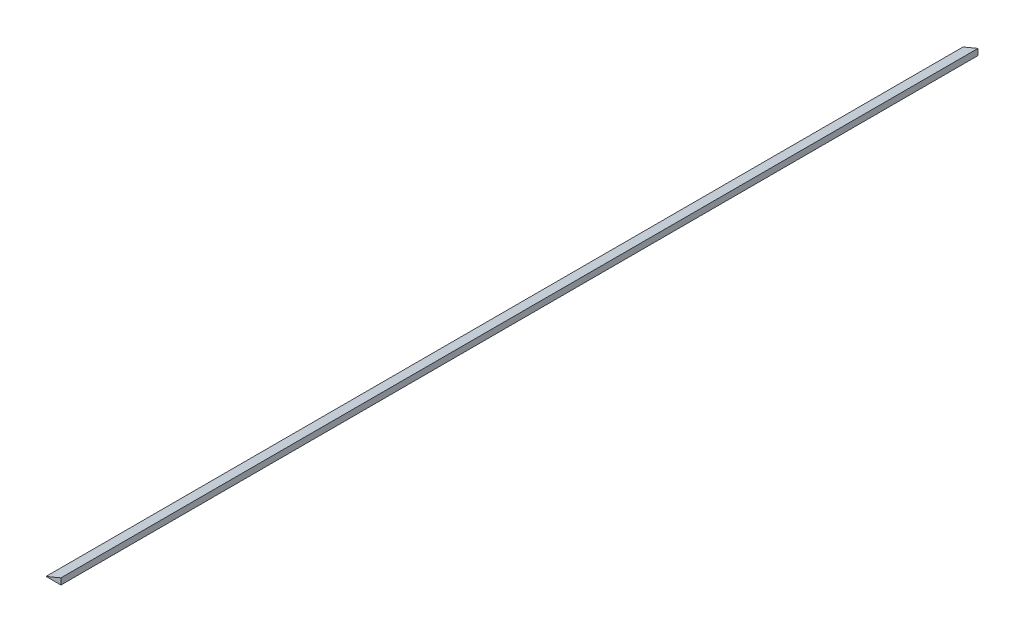
from build123d import *

# Parameters (mm, degrees)
BOSS_EXTRUDE1_DEPTH = 1168.4


with BuildPart() as part:
    # Sketch1 → Boss-Extrude1 (new body)
    with BuildSketch(Plane.XY):
        Polygon((0, 0), (19.05, 0), (19.05, 7.9375), align=None)
    extrude(amount=BOSS_EXTRUDE1_DEPTH)


solid = part.part
